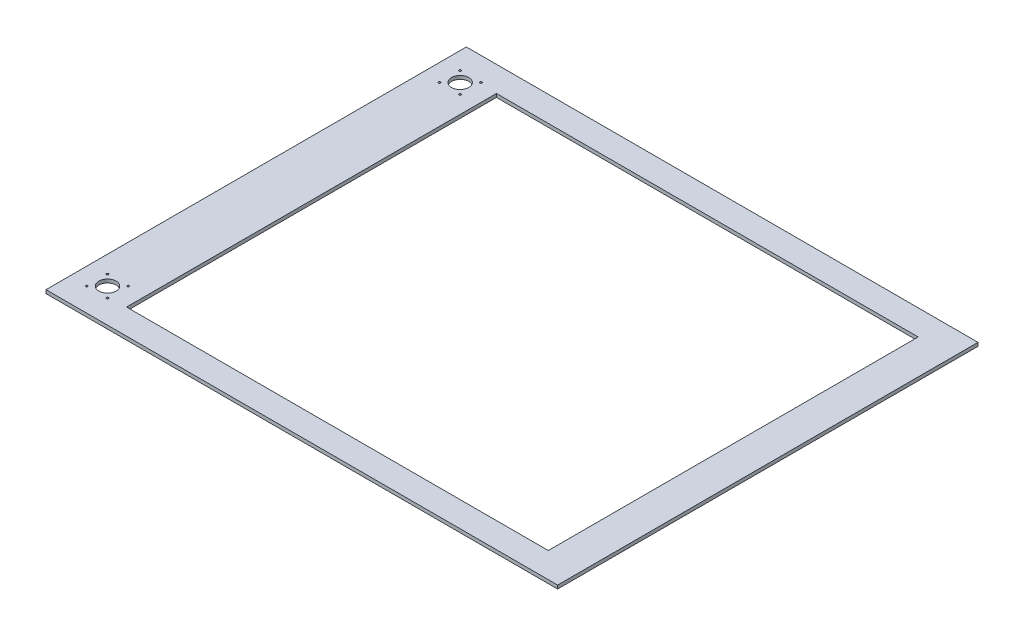
from build123d import *

# Parameters (mm, degrees)
SKETCH1_W           = 740
SKETCH1_H           = 608
SKETCH1_R           = 12.5
SKETCH1_R_2         = 1.5
SKETCH1_W_2         = 610
SKETCH1_H_2         = 535
BOSS_EXTRUDE1_DEPTH = 5


with BuildPart() as part:
    # Sketch1 → Boss-Extrude1 (new body)
    with BuildSketch(Plane(origin=(0, 0, 0), x_dir=(1, 0, 0), z_dir=(0, 1, 0))):
        with Locations((370, 304)):
            Rectangle(SKETCH1_W, SKETCH1_H)
        with Locations(Location((40, 559, 0), (0, 0, 270))):
            Circle(SKETCH1_R, mode=Mode.SUBTRACT)
        with Locations(Location((40, 49, 0), (0, 0, 270))):
            Circle(SKETCH1_R, mode=Mode.SUBTRACT)
        with Locations(Location((25, 64, 0), (0, 0, 270))):
            Circle(SKETCH1_R_2, mode=Mode.SUBTRACT)
        with Locations(Location((25, 34, 0), (0, 0, 270))):
            Circle(SKETCH1_R_2, mode=Mode.SUBTRACT)
        with Locations(Location((55, 34, 0), (0, 0, 270))):
            Circle(SKETCH1_R_2, mode=Mode.SUBTRACT)
        with Locations(Location((55, 64, 0), (0, 0, 270))):
            Circle(SKETCH1_R_2, mode=Mode.SUBTRACT)
        with Locations(Location((25, 574, 0), (0, 0, 270))):
            Circle(SKETCH1_R_2, mode=Mode.SUBTRACT)
        with Locations(Location((55, 574, 0), (0, 0, 270))):
            Circle(SKETCH1_R_2, mode=Mode.SUBTRACT)
        with Locations(Location((55, 544, 0), (0, 0, 270))):
            Circle(SKETCH1_R_2, mode=Mode.SUBTRACT)
        with Locations(Location((25, 544, 0), (0, 0, 270))):
            Circle(SKETCH1_R_2, mode=Mode.SUBTRACT)
        with Locations((385, 304)):
            Rectangle(SKETCH1_W_2, SKETCH1_H_2, mode=Mode.SUBTRACT)
    extrude(amount=BOSS_EXTRUDE1_DEPTH)


solid = part.part
